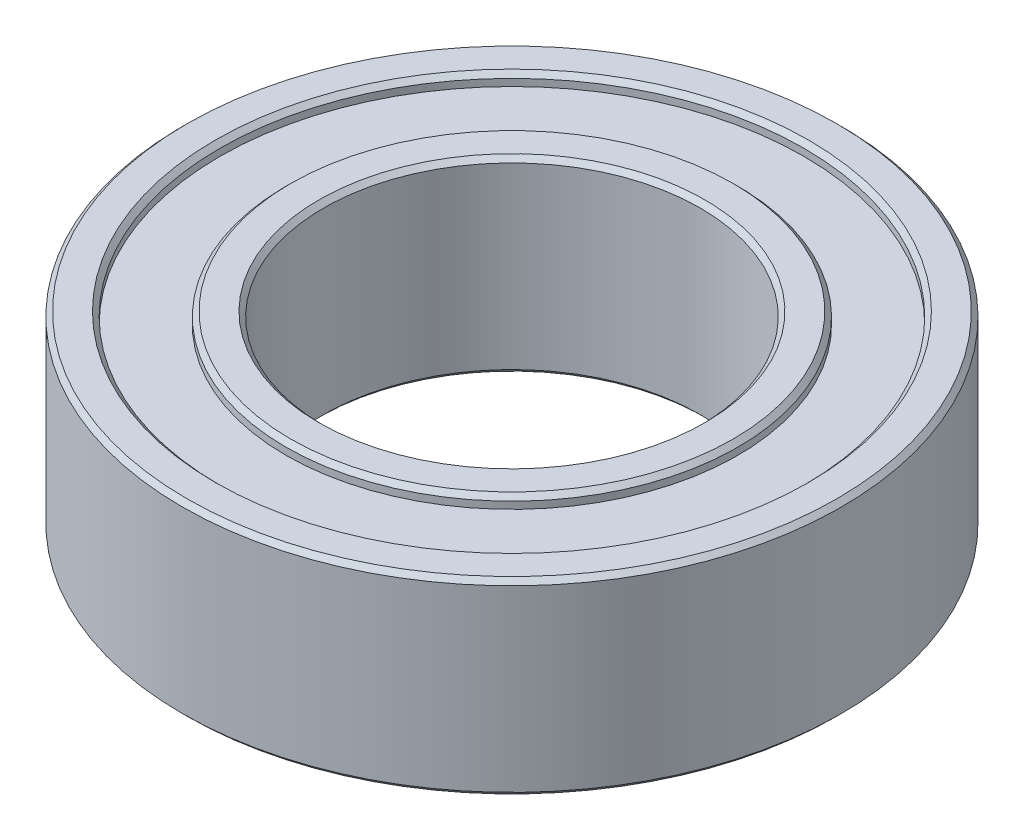
from build123d import *

# Parameters (mm, degrees)
SKETCH1_R             = 7
SKETCH1_R_2           = 6.2
BOSS_EXTRUDE1_DEPTH   = 2
SKETCH1_R_3           = 4.8
SKETCH1_R_4           = 4
BOSS_EXTRUDE1_2_DEPTH = 2
SKETCH1_3_R           = 6.2
SKETCH1_3_R_2         = 4.8
BOSS_EXTRUDE2_DEPTH   = 1.75
CHAMFER2_SIZE         = 0.1
CHAMFER3_SIZE         = 0.1


with BuildPart() as part:
    # Sketch1 → Boss-Extrude1 (new, symmetric)
    with BuildSketch(Plane(origin=(0, 0, 0), x_dir=(1, 0, 0), z_dir=(0, 1, 0))):
        Circle(SKETCH1_R)
        Circle(SKETCH1_R_2, mode=Mode.SUBTRACT)
    extrude(amount=BOSS_EXTRUDE1_DEPTH, both=True)

    # Chamfer3
    chamfer3_edges = [part.edges().sort_by_distance(p)[0] for p in [
        (-6.2, 2, 0),
        (-7, 2, 0),
        (-6.2, -2, 0),
        (-7, -2, 0),
    ]]
    chamfer(chamfer3_edges, length=CHAMFER3_SIZE)


with BuildPart() as body_2:
    # Sketch1 → Boss-Extrude1 2 (new, symmetric)
    with BuildSketch(Plane(origin=(0, 0, 0), x_dir=(1, 0, 0), z_dir=(0, 1, 0))):
        Circle(SKETCH1_R_3)
        Circle(SKETCH1_R_4, mode=Mode.SUBTRACT)
    extrude(amount=BOSS_EXTRUDE1_2_DEPTH, both=True)

    # Sketch1<3> → Boss-Extrude2 (add, symmetric)
    with BuildSketch(Plane(origin=(0, 0, 0), x_dir=(1, 0, 0), z_dir=(0, 1, 0))):
        Circle(SKETCH1_3_R)
        Circle(SKETCH1_3_R_2, mode=Mode.SUBTRACT)
    extrude(amount=BOSS_EXTRUDE2_DEPTH, both=True)

    # Chamfer2
    chamfer2_edges = [body_2.edges().sort_by_distance(p)[0] for p in [
        (-4.8, -2, 0),
        (-4, -2, 0),
        (-4.8, 2, 0),
        (-4, 2, 0),
    ]]
    chamfer(chamfer2_edges, length=CHAMFER2_SIZE)


solid = Compound([part.part, body_2.part])
